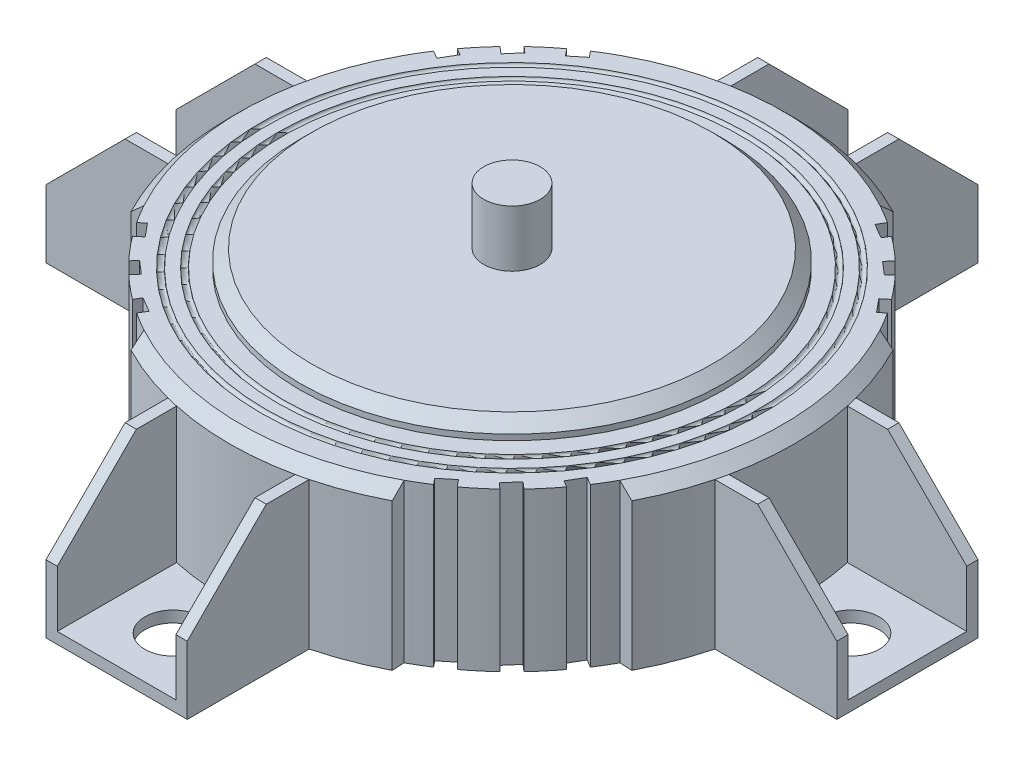
from build123d import *

# Parameters (mm, degrees)
CHAMFER1_SIZE                   = 2
BOSS_EXTRUDE1_DEPTH             = 70
CHAMFER2_SIZE                   = 14
SKETCH3_R                       = 5
CUT_EXTRUDE1_DEPTH              = 70
CIRPATTERN1_COUNT               = 4
CHAMFER2_OF_CIRPATTERN1_SIZE    = 14
CUT_EXTRUDE3_START              = 70
CUT_EXTRUDE3_DEPTH              = 70
CUT_EXTRUDE4_DEPTH              = 70
CIRPATTERN2_COUNT               = 2
CIRPATTERN2_ANGLE               = 10
CIRPATTERN2_THE_OTHER_WAY_COUNT = 2
CIRPATTERN2_THE_OTHER_WAY_ANGLE = 10
CIRPATTERN3_COUNT               = 4
CIRPATTERN3_COPY_1_DEPTH        = 70
CIRPATTERN3_COPY_2_DEPTH        = 70
CIRPATTERN3_COPY_3_DEPTH        = 70
CIRPATTERN3_COPY_4_DEPTH        = 70
CIRPATTERN3_COPY_5_DEPTH        = 70
CIRPATTERN3_COPY_6_DEPTH        = 70
CUT_SWEEP1_PROFILE_R            = 0.5
CUT_SWEEP2_PROFILE_R            = 0.5
CUT_EXTRUDE5_START              = -10
SKETCH41_R                      = 37.5
CUT_EXTRUDE5_DEPTH              = 10


with BuildPart() as part:
    # Sketch1 → Revolve1 (revolve)
    with BuildSketch(Plane.XY, mode=Mode.PRIVATE) as revolve1_sk:
        Polygon((0, 0), (-50, 0), (-50, 28), (-37.5, 28), (-37.5, 31), (-5, 31), (-5, 41), (0, 41), align=None)
    revolve(revolve1_sk.sketch.rotate(Axis((0, 0, 0), (0, 1, 0)), 270), axis=Axis((0, 0, 0), (0, 1, 0)))

    # Chamfer1
    chamfer1_edges = [part.edges().sort_by_distance(p)[0] for p in [
        (0, 31, 37.5),
        (0, 28, 50),
    ]]
    chamfer(chamfer1_edges, length=CHAMFER1_SIZE)

    # Sketch2 → Boss-Extrude1 (add)
    with BuildSketch(Plane.XY):
        Polygon((-10.5, 26), (-12.5, 26), (-12.5, 0), (12.5, 0), (12.5, 26), (10.5, 26), (10.5, 2), (-10.5, 2), align=None)
    boss_extrude1 = extrude(amount=BOSS_EXTRUDE1_DEPTH)

    # Chamfer2
    chamfer2_edges = [part.edges().sort_by_distance(p)[0] for p in [
        (-11.5, 26, 70),
        (11.5, 26, 70),
    ]]
    chamfer(chamfer2_edges, length=CHAMFER2_SIZE)

    # Sketch3 → Cut-Extrude1 (cut)
    with BuildSketch(Plane(origin=(0, 0, 0), x_dir=(1, 0, 0), z_dir=(0, 1, 0))):
        with Locations(Location((0, -60, 0), (0, 0, 90))):
            Circle(SKETCH3_R)
    cut_extrude1 = extrude(amount=CUT_EXTRUDE1_DEPTH, mode=Mode.SUBTRACT)

    # CirPattern1: Boss-Extrude1, Cut-Extrude1 ×4 about axis
    cirpattern1_axis = Axis((0, 0, 0), (0, 1, 0))
    add([boss_extrude1.rotate(cirpattern1_axis, i * 360 / CIRPATTERN1_COUNT) for i in range(1, CIRPATTERN1_COUNT)])
    add([cut_extrude1.rotate(cirpattern1_axis, i * 360 / CIRPATTERN1_COUNT) for i in range(1, CIRPATTERN1_COUNT)], mode=Mode.SUBTRACT)

    # Chamfer2 of CirPattern1
    chamfer2_of_cirpattern1_edges = [part.edges().sort_by_distance(p)[0] for p in [
        (70, 26, 11.5),
        (70, 26, -11.5),
        (11.5, 26, -70),
        (-11.5, 26, -70),
        (-70, 26, -11.5),
        (-70, 26, 11.5),
    ]]
    chamfer(chamfer2_of_cirpattern1_edges, length=CHAMFER2_OF_CIRPATTERN1_SIZE)

    # Sketch4 → Cut-Extrude3 (cut)
    with BuildSketch(Plane(origin=(0, 0, 0), x_dir=(1, 0, 0), z_dir=(0, 1, 0)).offset(CUT_EXTRUDE3_START)):
        with BuildLine():
            Line((42.117017672, -23.02513458), (44.333445626, -23.12024219))
            ThreePointArc((44.333445626, -23.12024219), (35.355339059, -35.355339059), (23.12024219, -44.333445626))
            Line((23.12024219, -44.333445626), (23.02513458, -42.117017672))
            ThreePointArc((23.02513458, -42.117017672), (33.941125497, -33.941125497), (42.117017672, -23.02513458))
        make_face()
    cut_extrude3 = extrude(amount=-CUT_EXTRUDE3_DEPTH, mode=Mode.SUBTRACT)

    # Sketch5 → Cut-Extrude4 (cut)
    with BuildSketch(Plane(origin=(0, 0, 0), x_dir=(1, 0, 0), z_dir=(0, 1, 0))):
        Polygon((34.104670422, -36.05613213), (31.826118864, -34.104670422), (33.777580572, -31.826118864), (36.05613213, -33.777580572), align=None)
    cut_extrude4 = extrude(amount=CUT_EXTRUDE4_DEPTH, mode=Mode.SUBTRACT)

    # CirPattern2: Cut-Extrude4 ×2 about axis
    cirpattern2_axis = Axis((0, 0, 0), (0, 1, 0))
    for i in range(1, CIRPATTERN2_COUNT):
        add(cut_extrude4.rotate(cirpattern2_axis, i * CIRPATTERN2_ANGLE / (CIRPATTERN2_COUNT - 1)), mode=Mode.SUBTRACT)

    # CirPattern2 the other way: Cut-Extrude4 ×2 about axis
    cirpattern2_the_other_way_axis = Axis((0, 0, 0), (0, -1, 0))
    for i in range(1, CIRPATTERN2_THE_OTHER_WAY_COUNT):
        add(cut_extrude4.rotate(cirpattern2_the_other_way_axis, i * CIRPATTERN2_THE_OTHER_WAY_ANGLE / (CIRPATTERN2_THE_OTHER_WAY_COUNT - 1)), mode=Mode.SUBTRACT)

    # CirPattern3: Cut-Extrude3, Cut-Extrude4 ×4 about axis
    cirpattern3_axis = Axis((0, 0, 0), (0, 1, 0))
    add([cut_extrude3.rotate(cirpattern3_axis, i * 360 / CIRPATTERN3_COUNT) for i in range(1, CIRPATTERN3_COUNT)], mode=Mode.SUBTRACT)
    add([cut_extrude4.rotate(cirpattern3_axis, i * 360 / CIRPATTERN3_COUNT) for i in range(1, CIRPATTERN3_COUNT)], mode=Mode.SUBTRACT)

    # CirPattern3 copy 1 sketch → CirPattern3 copy 1 (cut)
    with BuildSketch(Plane(origin=(0, 0, 0), x_dir=(-0.1736481776669307, 0, -0.984807753012208), z_dir=(0, 1, 0))):
        Polygon((34.104670422, -36.05613213), (31.826118864, -34.104670422), (33.777580572, -31.826118864), (36.05613213, -33.777580572), align=None)
    extrude(amount=CIRPATTERN3_COPY_1_DEPTH, mode=Mode.SUBTRACT)

    # CirPattern3 copy 2 sketch → CirPattern3 copy 2 (cut)
    with BuildSketch(Plane(origin=(0, 0, 0), x_dir=(-0.984807753012208, 0, 0.17364817766693064), z_dir=(0, 1, 0))):
        Polygon((34.104670422, -36.05613213), (31.826118864, -34.104670422), (33.777580572, -31.826118864), (36.05613213, -33.777580572), align=None)
    extrude(amount=CIRPATTERN3_COPY_2_DEPTH, mode=Mode.SUBTRACT)

    # CirPattern3 copy 3 sketch → CirPattern3 copy 3 (cut)
    with BuildSketch(Plane(origin=(0, 0, 0), x_dir=(0.17364817766693055, 0, 0.984807753012208), z_dir=(0, 1, 0))):
        Polygon((34.104670422, -36.05613213), (31.826118864, -34.104670422), (33.777580572, -31.826118864), (36.05613213, -33.777580572), align=None)
    extrude(amount=CIRPATTERN3_COPY_3_DEPTH, mode=Mode.SUBTRACT)

    # CirPattern3 copy 4 sketch → CirPattern3 copy 4 (cut)
    with BuildSketch(Plane(origin=(0, 0, 0), x_dir=(0.1736481776669308, 0, -0.984807753012208), z_dir=(0, 1, 0))):
        Polygon((34.104670422, -36.05613213), (31.826118864, -34.104670422), (33.777580572, -31.826118864), (36.05613213, -33.777580572), align=None)
    extrude(amount=CIRPATTERN3_COPY_4_DEPTH, mode=Mode.SUBTRACT)

    # CirPattern3 copy 5 sketch → CirPattern3 copy 5 (cut)
    with BuildSketch(Plane(origin=(0, 0, 0), x_dir=(-0.984807753012208, 0, -0.17364817766693086), z_dir=(0, 1, 0))):
        Polygon((34.104670422, -36.05613213), (31.826118864, -34.104670422), (33.777580572, -31.826118864), (36.05613213, -33.777580572), align=None)
    extrude(amount=CIRPATTERN3_COPY_5_DEPTH, mode=Mode.SUBTRACT)

    # CirPattern3 copy 6 sketch → CirPattern3 copy 6 (cut)
    with BuildSketch(Plane(origin=(0, 0, 0), x_dir=(-0.17364817766693094, 0, 0.984807753012208), z_dir=(0, 1, 0))):
        Polygon((34.104670422, -36.05613213), (31.826118864, -34.104670422), (33.777580572, -31.826118864), (36.05613213, -33.777580572), align=None)
    extrude(amount=CIRPATTERN3_COPY_6_DEPTH, mode=Mode.SUBTRACT)

    # Cut-Sweep1: sweep along a path in Sketch9
    with BuildLine(Plane(origin=(0, 28, 0), x_dir=(1, 0, 0), z_dir=(0, 1, 0))) as cut_sweep1_path:
        CenterArc((0, 0), 41, 0, 360)
    # Cut-Sweep1 profile (on start of the path) → Cut-Sweep1 (sweep, cut)
    with BuildSketch(Plane(origin=(41, 28, 0), x_dir=(-1, 0, 0), z_dir=(0, 0, -1))):
        Circle(CUT_SWEEP1_PROFILE_R)
    sweep(path=cut_sweep1_path.line, mode=Mode.SUBTRACT)

    # Cut-Sweep2: sweep along a path in Sketch10
    with BuildLine(Plane(origin=(0, 28, 0), x_dir=(1, 0, 0), z_dir=(0, 1, 0))) as cut_sweep2_path:
        CenterArc((0, 0), 44, 0, 360)
    # Cut-Sweep2 profile (on start of the path) → Cut-Sweep2 (sweep, cut)
    with BuildSketch(Plane(origin=(44, 28, 0), x_dir=(-1, 0, 0), z_dir=(0, 0, -1))):
        Circle(CUT_SWEEP2_PROFILE_R)
    sweep(path=cut_sweep2_path.line, mode=Mode.SUBTRACT)

    # Sketch41 → Cut-Extrude5 (cut)
    with BuildSketch(Plane.XZ.offset(CUT_EXTRUDE5_START)):
        with Locations(Location((0, 0, 0), (0, 0, 270))):
            Circle(SKETCH41_R)
    extrude(amount=CUT_EXTRUDE5_DEPTH, mode=Mode.SUBTRACT)


solid = part.part
